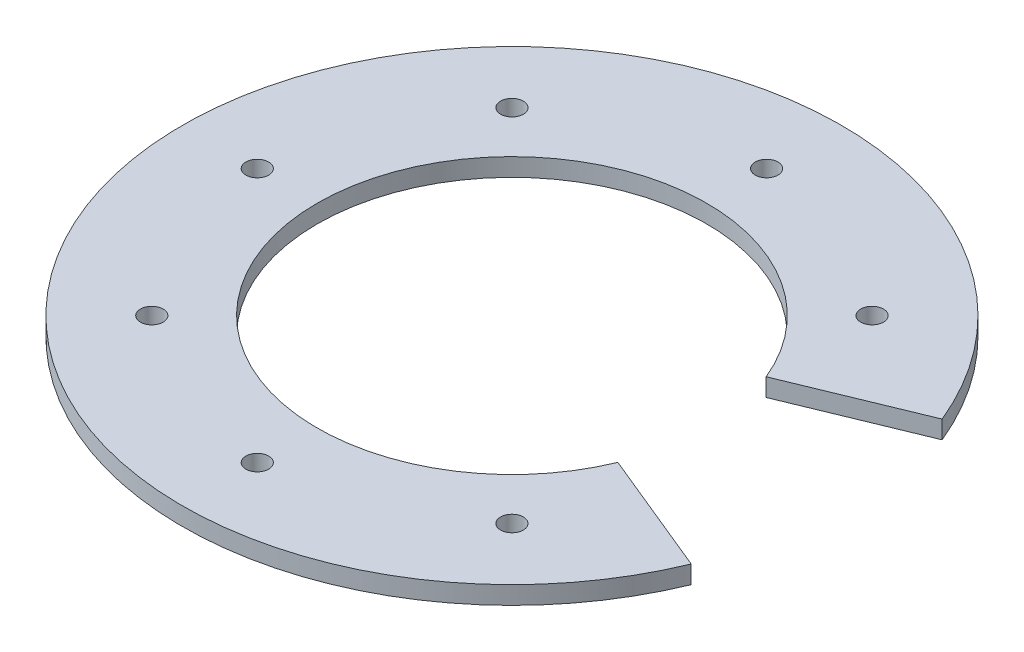
from build123d import *

# Parameters (mm, degrees)
SKETCH1_R           = 1.9
BOSS_EXTRUDE1_DEPTH = 3


with BuildPart() as part:
    # Sketch1 → Boss-Extrude1 (new body)
    with BuildSketch(Plane(origin=(0, 0, 0), x_dir=(1, 0, 0), z_dir=(0, 1, 0))):
        with BuildLine():
            Line((30.0520382, 12.374368671), (50.857295416, 20.941239289))
            ThreePointArc((50.857295416, 20.941239289), (-55, 0), (50.857295416, -20.941239289))
            Line((50.857295416, -20.941239289), (30.0520382, -12.374368671))
            ThreePointArc((30.0520382, -12.374368671), (-32.5, 0), (30.0520382, 12.374368671))
        make_face()
        with Locations(Location((0, 42.5, 0), (0, 0, 270))):
            Circle(SKETCH1_R, mode=Mode.SUBTRACT)
        with Locations(Location((30.0520382, 30.0520382, 0), (0, 0, 270))):
            Circle(SKETCH1_R, mode=Mode.SUBTRACT)
        with Locations(Location((30.0520382, -30.0520382, 0), (0, 0, 270))):
            Circle(SKETCH1_R, mode=Mode.SUBTRACT)
        with Locations(Location((0, -42.5, 0), (0, 0, 270))):
            Circle(SKETCH1_R, mode=Mode.SUBTRACT)
        with Locations(Location((-30.0520382, -30.0520382, 0), (0, 0, 270))):
            Circle(SKETCH1_R, mode=Mode.SUBTRACT)
        with Locations(Location((-42.5, 0, 0), (0, 0, 270))):
            Circle(SKETCH1_R, mode=Mode.SUBTRACT)
        with Locations(Location((-30.0520382, 30.0520382, 0), (0, 0, 270))):
            Circle(SKETCH1_R, mode=Mode.SUBTRACT)
    extrude(amount=BOSS_EXTRUDE1_DEPTH)


solid = part.part
